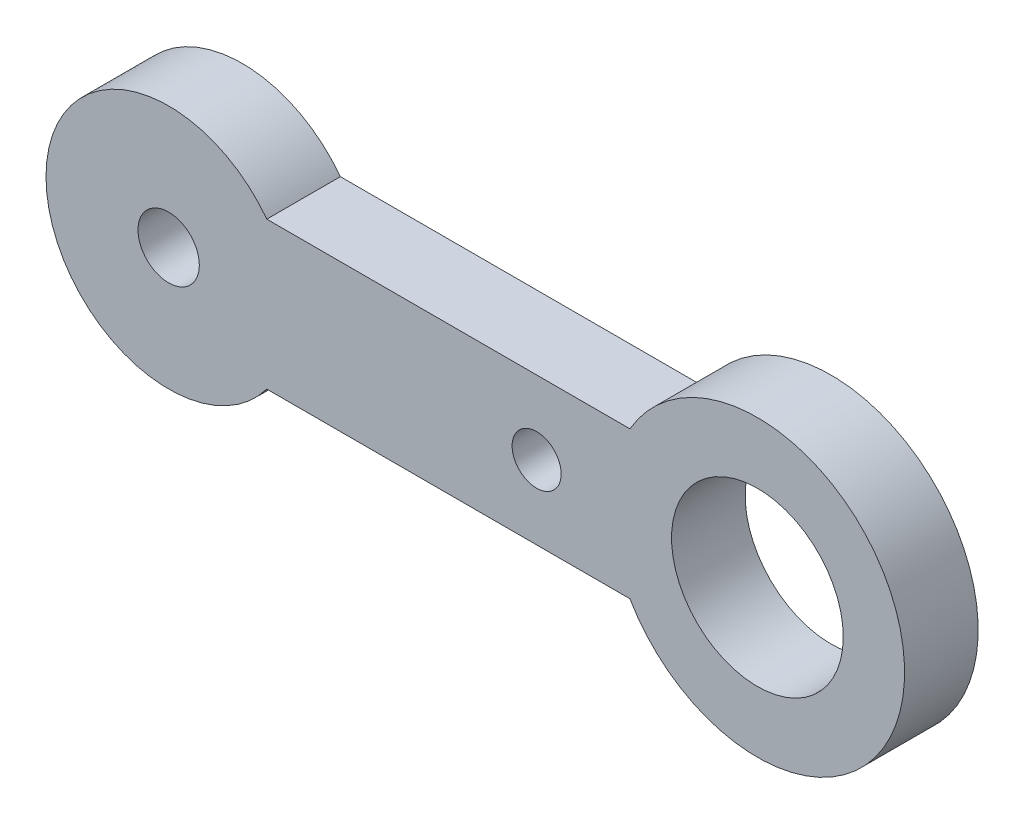
from build123d import *

# Parameters (mm, degrees)
SKETCH2_R           = 1.25
SKETCH2_R_2         = 3.5
SKETCH2_R_3         = 1
BOSS_EXTRUDE1_DEPTH = 3


with BuildPart() as part:
    # Sketch2 → Boss-Extrude1 (new body)
    with BuildSketch(Plane.XY):
        with BuildLine():
            Line((2.693779904, 3), (17.497627482, 3))
            ThreePointArc((17.497627482, 3), (28.693779904, 0), (17.497627482, -3))
            Line((17.497627482, -3), (2.693779904, -3))
            ThreePointArc((2.693779904, -3), (-6.306220096, 0), (2.693779904, 3))
        make_face()
        with Locations((-1.306220096, 0)):
            Circle(SKETCH2_R, mode=Mode.SUBTRACT)
        with Locations((22.693779904, 0)):
            Circle(SKETCH2_R_2, mode=Mode.SUBTRACT)
        with Locations((13.693779904, 0)):
            Circle(SKETCH2_R_3, mode=Mode.SUBTRACT)
    extrude(amount=BOSS_EXTRUDE1_DEPTH)


solid = part.part
